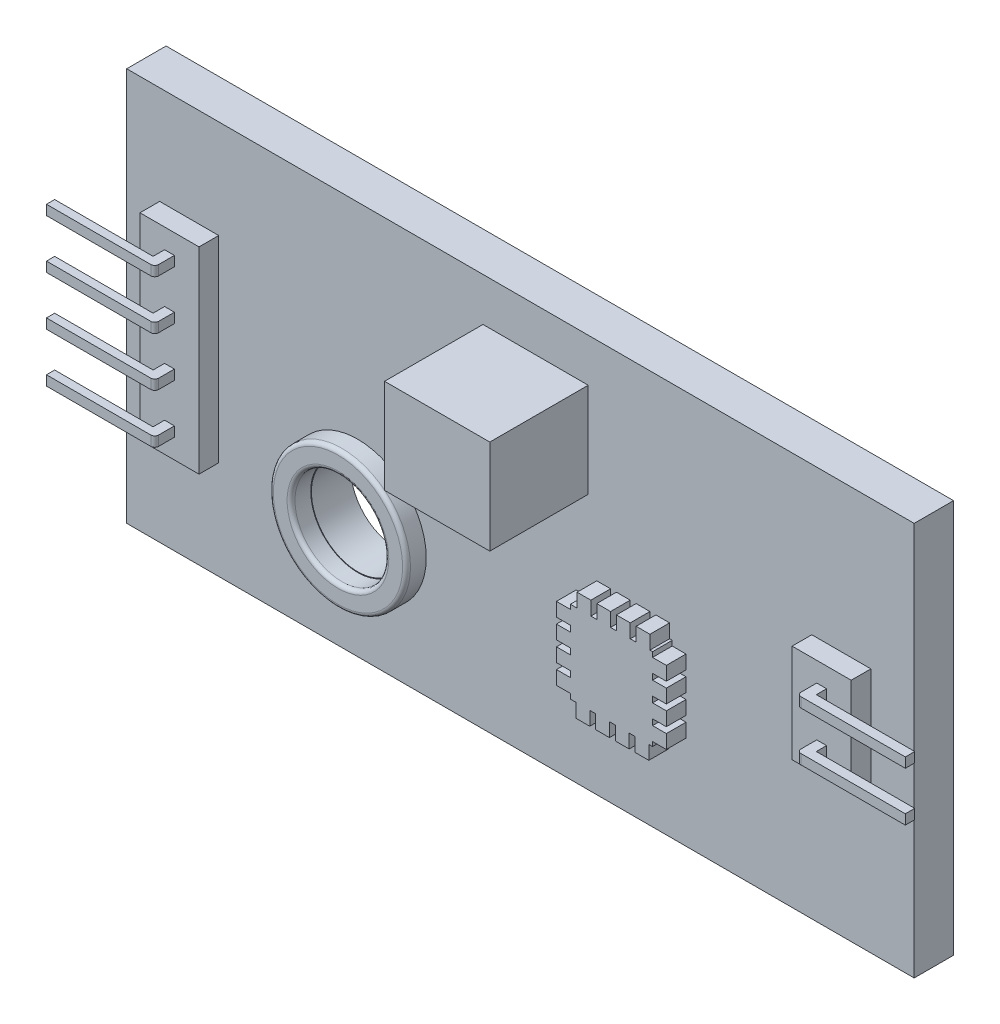
from build123d import *

# Parameters (mm, degrees)
SKETCH1_W           = 40
SKETCH1_H           = 20
BOSS_EXTRUDE1_DEPTH = 2
SKETCH2_W           = 3
SKETCH2_H           = 10
SKETCH2_H_2         = 5
BOSS_EXTRUDE2_DEPTH = 1
SKETCH3_W           = 0.5
SKETCH3_H           = 0.5
BOSS_EXTRUDE3_DEPTH = 1
SKETCH5_W           = 0.415981526
SKETCH5_H           = 0.5
BOSS_EXTRUDE4_DEPTH = 5
FILLET1_R           = 0.2
SKETCH7_W           = 0.477868842
SKETCH7_H           = 0.5
BOSS_EXTRUDE5_DEPTH = 5
FILLET3_R           = 0.2
SKETCH8_W           = 5.346247603
SKETCH8_H           = 4.799297503
BOSS_EXTRUDE6_DEPTH = 5
BOSS_EXTRUDE8_DEPTH = 1
CUT_EXTRUDE1_REACH  = 30.088
SKETCH10_R          = 2.349261849
SKETCH13_R          = 3.48485592
BOSS_EXTRUDE9_DEPTH = 1
CUT_EXTRUDE2_REACH  = 30.088
SKETCH14_R          = 2.382418239
FILLET5_R           = 0.2


with BuildPart() as part:
    # Sketch1 → Boss-Extrude1 (new body)
    with BuildSketch(Plane.XY):
        with Locations((-3.443579767, -0.612840467)):
            Rectangle(SKETCH1_W, SKETCH1_H)
    extrude(amount=BOSS_EXTRUDE1_DEPTH)

    # Sketch2 → Boss-Extrude2 (add)
    with BuildSketch(Plane.XY.offset(2)):
        with Locations((-20.270719319, -0.612840467)):
            Rectangle(SKETCH2_W, SKETCH2_H)
        with Locations((12.857244344, -0.612840467)):
            Rectangle(SKETCH2_W, SKETCH2_H_2)
    extrude(amount=BOSS_EXTRUDE2_DEPTH)

    # Sketch3 → Boss-Extrude3 (add)
    with BuildSketch(Plane.XY.offset(3)):
        with Locations((-20.270719319, 3.137159533)):
            Rectangle(SKETCH3_W, SKETCH3_H)
        with Locations((-20.270719319, 0.637159533)):
            Rectangle(SKETCH3_W, SKETCH3_H)
        with Locations((-20.270719319, -1.862840467)):
            Rectangle(SKETCH3_W, SKETCH3_H)
        with Locations((-20.270719319, -4.362840467)):
            Rectangle(SKETCH3_W, SKETCH3_H)
        with Locations((12.857244344, -1.862840467)):
            Rectangle(SKETCH3_W, SKETCH3_H)
        with Locations((12.857244344, 0.637159533)):
            Rectangle(SKETCH3_W, SKETCH3_H)
    extrude(amount=BOSS_EXTRUDE3_DEPTH)

    # Sketch5 → Boss-Extrude4 (add)
    with BuildSketch(Plane.ZY.offset(20.520719319)):
        with Locations((3.792009237, 3.137159533)):
            Rectangle(SKETCH5_W, SKETCH5_H)
        with Locations((3.792009237, 0.637159533)):
            Rectangle(SKETCH5_W, SKETCH5_H)
        with Locations((3.792009237, -1.862840467)):
            Rectangle(SKETCH5_W, SKETCH5_H)
        with Locations((3.792009237, -4.362840467)):
            Rectangle(SKETCH5_W, SKETCH5_H)
    extrude(amount=BOSS_EXTRUDE4_DEPTH)

    # Fillet1
    fillet1_edges = [part.edges().sort_by_distance(p)[0] for p in [
        (-20.020719319, 3.137159533, 4),
        (-20.020719319, 0.637159533, 4),
        (-20.020719319, -1.862840467, 4),
        (-20.020719319, -4.362840467, 4),
    ]]
    fillet(fillet1_edges, radius=FILLET1_R)

    # Sketch7 → Boss-Extrude5 (add)
    with BuildSketch(Plane(origin=(13.107244344, 0, 0), x_dir=(0, 0, -1), z_dir=(1, 0, 0))):
        with Locations((-3.761065579, -1.862840467)):
            Rectangle(SKETCH7_W, SKETCH7_H)
        with Locations((-3.761065579, 0.637159533)):
            Rectangle(SKETCH7_W, SKETCH7_H)
    extrude(amount=BOSS_EXTRUDE5_DEPTH)

    # Fillet3
    fillet3_edges = [part.edges().sort_by_distance(p)[0] for p in [
        (12.607244344, -1.862840467, 4),
        (12.607244344, 0.637159533, 4),
    ]]
    fillet(fillet3_edges, radius=FILLET3_R)

    # Sketch8 → Boss-Extrude6 (add)
    with BuildSketch(Plane.XY.offset(2)):
        with Locations((-2.673123802, 4.786787988)):
            Rectangle(SKETCH8_W, SKETCH8_H)
    extrude(amount=BOSS_EXTRUDE6_DEPTH)

    # Sketch9 → Boss-Extrude8 (add)
    with BuildSketch(Plane.XY.offset(2)):
        Polygon((0.091656416, -4.824510849), (-0.615226542, -4.824510849), (-0.615226542, -4.128822948), (0.091656416, -4.128822948), (0.091656416, -3.824510849), (-0.615226542, -3.824510849), (-0.615226542, -3.128822948), (0.091656416, -3.128822948), (0.091656416, -2.824510849), (-0.615226542, -2.824510849), (-0.615226542, -2.128822948), (0.091656416, -2.128822948), (0.091656416, -1.902319725), (0.43302666, -1.902319725), (0.43302666, -1.202319725), (1.13302666, -1.202319725), (1.13302666, -1.902319725), (1.43302666, -1.902319725), (1.43302666, -1.202319725), (2.13302666, -1.202319725), (2.13302666, -1.902319725), (2.43302666, -1.902319725), (2.43302666, -1.202319725), (3.13302666, -1.202319725), (3.13302666, -1.902319725), (3.43302666, -1.902319725), (3.43302666, -1.202319725), (4.13302666, -1.202319725), (4.13302666, -1.902319725), (4.266316816, -1.902319725), (4.266316816, -2.154701216), (4.966316816, -2.154701216), (4.966316816, -2.854701216), (4.266316816, -2.854701216), (4.266316816, -3.154701216), (4.966316816, -3.154701216), (4.966316816, -3.854701216), (4.266316816, -3.854701216), (4.266316816, -4.154701216), (4.966316816, -4.154701216), (4.966316816, -4.854701216), (4.266316816, -4.854701216), (4.266316816, -5.154701216), (4.966316816, -5.154701216), (4.966316816, -5.854701216), (4.266316816, -5.854701216), (4.266316816, -6.07698014), (4.077584514, -6.07698014), (4.077584514, -6.77698014), (3.377584514, -6.77698014), (3.377584514, -6.07698014), (3.077584514, -6.07698014), (3.077584514, -6.77698014), (2.377584514, -6.77698014), (2.377584514, -6.07698014), (2.077584514, -6.07698014), (2.077584514, -6.77698014), (1.377584514, -6.77698014), (1.377584514, -6.07698014), (1.077584514, -6.07698014), (1.077584514, -6.77698014), (0.377584514, -6.77698014), (0.377584514, -6.07698014), (0.091656416, -6.07698014), (0.091656416, -5.824510849), (-0.615226542, -5.824510849), (-0.615226542, -5.128822948), (0.091656416, -5.128822948), align=None)
    extrude(amount=BOSS_EXTRUDE8_DEPTH)

    # Sketch10 → Cut-Extrude1 (cut, up to next)
    with BuildSketch(Plane.XY.offset(2), mode=Mode.PRIVATE) as cut_extrude1_sk1:
        with Locations((-11.713689096, -4.527627409)):
            Circle(SKETCH10_R)
    cut_extrude1_tool1 = extrude(cut_extrude1_sk1.sketch, amount=-CUT_EXTRUDE1_REACH, mode=Mode.PRIVATE) & part.part
    add(cut_extrude1_tool1.solids().sort_by_distance((-11.713689, -4.527627, 2))[0], mode=Mode.SUBTRACT)

    # Sketch13 → Boss-Extrude9 (add)
    with BuildSketch(Plane.XY.offset(2)):
        with Locations((-11.713689096, -4.527627409)):
            Circle(SKETCH13_R)
    extrude(amount=BOSS_EXTRUDE9_DEPTH)

    # Sketch14 → Cut-Extrude2 (cut, up to next)
    with BuildSketch(Plane(origin=(0, 0, 2), x_dir=(-1, 0, 0), z_dir=(0, 0, -1)), mode=Mode.PRIVATE) as cut_extrude2_sk1:
        with Locations((11.713689096, -4.527627409)):
            Circle(SKETCH14_R)
    cut_extrude2_tool1 = extrude(cut_extrude2_sk1.sketch, amount=-CUT_EXTRUDE2_REACH, mode=Mode.PRIVATE) & part.part
    add(cut_extrude2_tool1.solids().sort_by_distance((-11.713689, -4.527627, 2))[0], mode=Mode.SUBTRACT)

    # Fillet5
    fillet5_edges = [part.edges().sort_by_distance(p)[0] for p in [
        (-15.198545015, -4.527627409, 3),
        (-9.331270856, -4.527627409, 3),
    ]]
    fillet(fillet5_edges, radius=FILLET5_R)


solid = part.part
